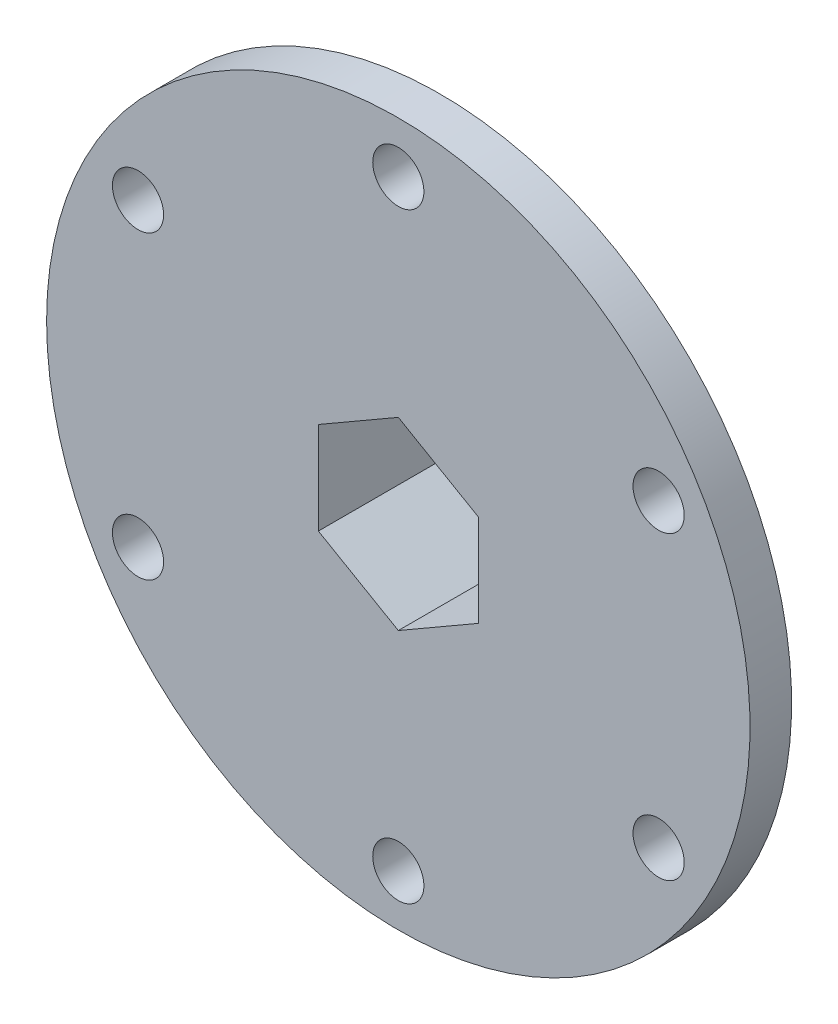
from build123d import *

# Parameters (mm, degrees)
SKETCH1_R           = 27.94
SKETCH1_R_2         = 2.032
BOSS_EXTRUDE1_DEPTH = 3.302
SKETCH2_R           = 14.224
BOSS_EXTRUDE2_DEPTH = 9.398
CUT_EXTRUDE1_DEPTH  = 12.7


with BuildPart() as part:
    # Sketch1 → Boss-Extrude1 (new body)
    with BuildSketch(Plane.XY):
        with Locations(Location((0, 0, 0), (0, 0, 180))):
            Circle(SKETCH1_R)
        with Locations(Location((0, 23.876, 0), (0, 0, 180))):
            Circle(SKETCH1_R_2, mode=Mode.SUBTRACT)
        with Locations(Location((20.677222541, 11.938, 0), (0, 0, 180))):
            Circle(SKETCH1_R_2, mode=Mode.SUBTRACT)
        with Locations(Location((20.677222541, -11.938, 0), (0, 0, 180))):
            Circle(SKETCH1_R_2, mode=Mode.SUBTRACT)
        with Locations(Location((0, -23.876, 0), (0, 0, 180))):
            Circle(SKETCH1_R_2, mode=Mode.SUBTRACT)
        with Locations(Location((-20.677222541, -11.938, 0), (0, 0, 180))):
            Circle(SKETCH1_R_2, mode=Mode.SUBTRACT)
        with Locations(Location((-20.677222541, 11.938, 0), (0, 0, 180))):
            Circle(SKETCH1_R_2, mode=Mode.SUBTRACT)
    extrude(amount=BOSS_EXTRUDE1_DEPTH)

    # Sketch2 → Boss-Extrude2 (add)
    with BuildSketch(Plane(origin=(0, 0, 0), x_dir=(-1, 0, 0), z_dir=(0, 0, -1))):
        with Locations(Location((0, 0, 0), (0, 0, 180))):
            Circle(SKETCH2_R)
    extrude(amount=BOSS_EXTRUDE2_DEPTH)

    # Sketch3 → Cut-Extrude1 (cut)
    with BuildSketch(Plane(origin=(0, 0, -9.398), x_dir=(-1, 0, 0), z_dir=(0, 0, -1))):
        Polygon((0, 7.332348419), (-6.35, 3.666174209), (-6.35, -3.666174209), (0, -7.332348419), (6.35, -3.666174209), (6.35, 3.666174209), align=None)
    extrude(amount=-CUT_EXTRUDE1_DEPTH, mode=Mode.SUBTRACT)


solid = part.part
